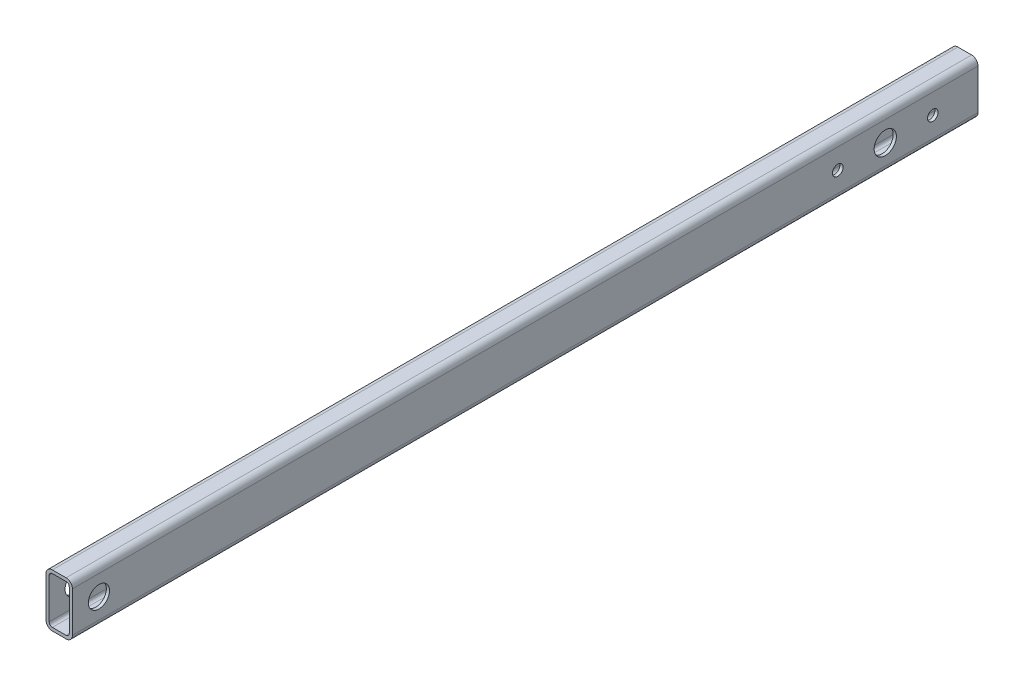
from build123d import *

# Parameters (mm, degrees)
BOSS_EXTRUDE1_DEPTH      = 785
BOSS_EXTRUDE1_DEPTH_BACK = 70
SKETCH3_R                = 10.5
SKETCH3_R_2              = 5
CUT_EXTRUDE1_DEPTH       = 787.986697046


with BuildPart() as part:
    # Sketch1 → Boss-Extrude1 (new, two sides: drawn at the far end of the back side and taken through both)
    with BuildSketch(Plane.XY.offset(-BOSS_EXTRUDE1_DEPTH_BACK)):
        with BuildLine():
            Line((0, 44), (0, 6))
            ThreePointArc((0, 6), (1.757359313, 1.757359313), (6, 0))
            Line((6, 0), (18.96119643, 0))
            ThreePointArc((18.96119643, 0), (23.203837117, 1.757359313), (24.96119643, 6))
            Line((24.96119643, 6), (24.96119643, 44))
            ThreePointArc((24.96119643, 44), (23.203837117, 48.242640687), (18.96119643, 50))
            Line((18.96119643, 50), (6, 50))
            ThreePointArc((6, 50), (1.757359313, 48.242640687), (0, 44))
        make_face()
        with BuildLine():
            Line((3, 44), (3, 6))
            ThreePointArc((3, 6), (3.878679656, 3.878679656), (6, 3))
            Line((6, 3), (18.96119643, 3))
            ThreePointArc((18.96119643, 3), (21.082516774, 3.878679656), (21.96119643, 6))
            Line((21.96119643, 6), (21.96119643, 44))
            ThreePointArc((21.96119643, 44), (21.082516774, 46.121320344), (18.96119643, 47))
            Line((18.96119643, 47), (6, 47))
            ThreePointArc((6, 47), (3.878679656, 46.121320344), (3, 44))
        make_face(mode=Mode.SUBTRACT)
    extrude(amount=BOSS_EXTRUDE1_DEPTH + BOSS_EXTRUDE1_DEPTH_BACK)

    # Sketch3 → Cut-Extrude1 (cut, through all)
    with BuildSketch(Plane(origin=(24.96119643, 0, 0), x_dir=(0, 0, -1), z_dir=(1, 0, 0))):
        with Locations(Location((-17.550291159, 25, 0), (0, 0, 90))):
            Circle(SKETCH3_R)
        with Locations(Location((-62.400291159, 25, 0), (0, 0, 90))):
            Circle(SKETCH3_R_2)
        with BuildLine():
            ThreePointArc((-750, 25), (-760, 35), (-770, 25))
            Line((-770, 25), (-760, 25))
            Line((-760, 25), (-750, 25))
        make_face()
        with BuildLine():
            Line((-760, 25), (-770, 25))
            ThreePointArc((-770, 25), (-760, 15), (-750, 25))
            Line((-750, 25), (-760, 25))
        make_face()
        with Locations(Location((27.299708841, 25, 0), (0, 0, 90))):
            Circle(SKETCH3_R_2)
    extrude(amount=-CUT_EXTRUDE1_DEPTH, mode=Mode.SUBTRACT)


solid = part.part
